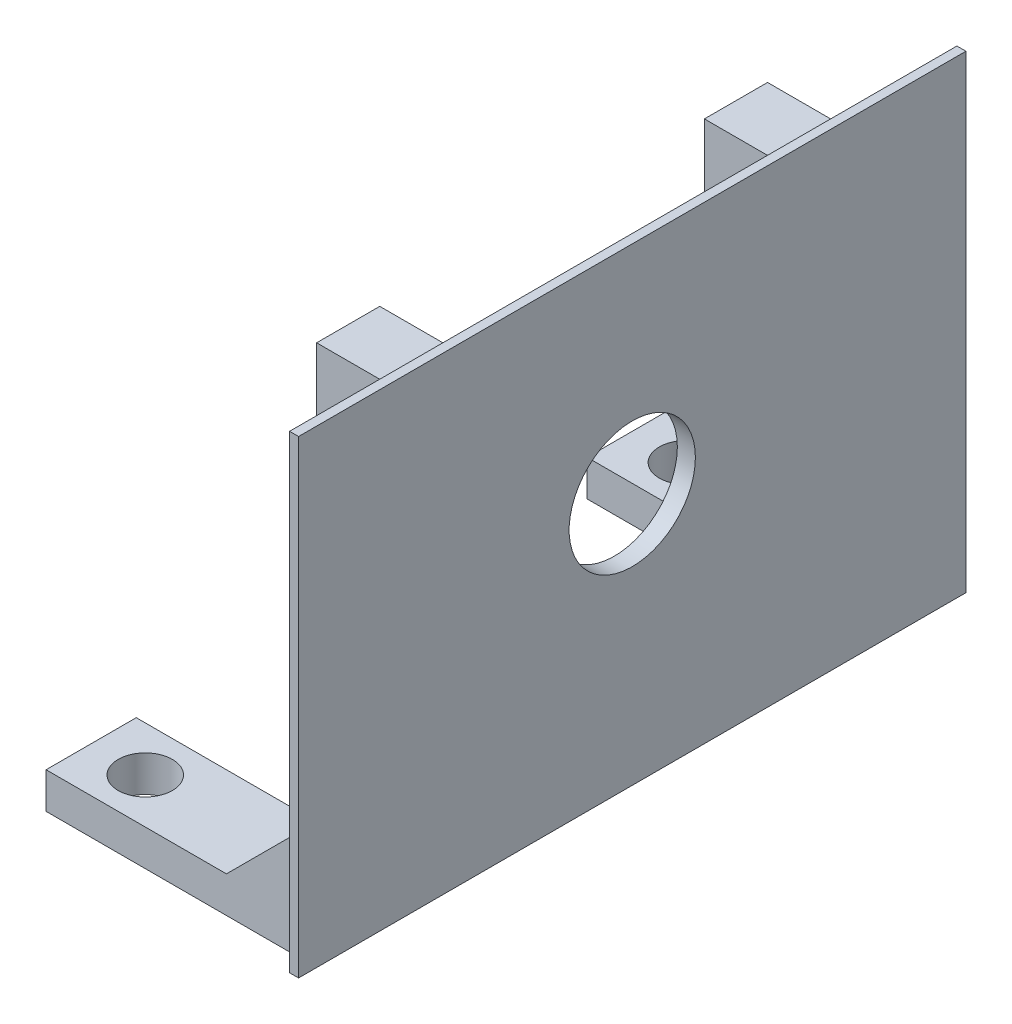
from build123d import *

# Parameters (mm, degrees)
SKIZZE2_W                      = 25
SKIZZE2_H                      = 25
SKIZZE2_R                      = 3.5
FRONT_FACE_DEPTH               = 1
SKIZZE3_W                      = 3.5
SKIZZE3_H                      = 26
SKIZZE3_R                      = 0.75
CAMERA_SPACER_DEPTH            = 4
FLOOR_PLATE_DEPTH              = 14
FLOOR_PLATE_DEPTH_BACK         = 0.5
SKIZZE6_W                      = 5
SKIZZE6_H                      = 2
SKIZZE7_W                      = 6
SKIZZE7_H                      = 26
SIDE_COVERS_DEPTH              = 0.5
TOP_COVER_REACH                = 34.669
SKIZZE8_W                      = 25
SKIZZE8_H                      = 1
FASE1_SIZE                     = 4.5
F_3_0_3_DURCHMESSER_BOHRUNG1_D = 3


with BuildPart() as part:
    # Skizze2 → Front Face (new body)
    # profile 1 of 2: a face of its own
    with BuildSketch(Plane(origin=(0, 0, 0), x_dir=(0, 0, -1), z_dir=(1, 0, 0))):
        with Locations((0, 12.5)):
            Rectangle(SKIZZE2_W, SKIZZE2_H)
        with Locations((0, 13)):
            Circle(SKIZZE2_R, mode=Mode.SUBTRACT)
    # profile 2 of 2: a face of its own
    with BuildSketch(Plane(origin=(0, 0, 0), x_dir=(0, 0, -1), z_dir=(1, 0, 0))):
        Polygon((12.5, 0), (-12.5, 0), (-17.5, 0), (-17.5, -1), (17.5, -1), (17.5, 0), align=None)
    extrude(amount=FRONT_FACE_DEPTH)

    # Skizze3 → Camera Spacer (add)
    # profile 1 of 2: a face of its own
    with BuildSketch(Plane.ZY):
        with Locations((-10.75, 12)):
            Rectangle(SKIZZE3_W, SKIZZE3_H)
        with Locations((-10.75, 14)):
            Circle(SKIZZE3_R, mode=Mode.SUBTRACT)
        with Locations((-10.75, 1.5)):
            Circle(SKIZZE3_R, mode=Mode.SUBTRACT)
    # profile 2 of 2: a face of its own
    with BuildSketch(Plane.ZY):
        with Locations((10.75, 12)):
            Rectangle(SKIZZE3_W, SKIZZE3_H)
        with Locations((10.75, 1.5)):
            Circle(SKIZZE3_R, mode=Mode.SUBTRACT)
        with Locations((10.75, 14)):
            Circle(SKIZZE3_R, mode=Mode.SUBTRACT)
    extrude(amount=CAMERA_SPACER_DEPTH)

    # Skizze6 → Floor Plate (add, two sides: drawn at the far end of the back side and taken through both)
    with BuildSketch(Plane.ZY.offset(-FLOOR_PLATE_DEPTH_BACK)):
        with Locations((-15, 0)):
            Rectangle(SKIZZE6_W, SKIZZE6_H)
        with Locations((15, 0)):
            Rectangle(SKIZZE6_W, SKIZZE6_H)
    extrude(amount=FLOOR_PLATE_DEPTH + FLOOR_PLATE_DEPTH_BACK)

    # Skizze7 → Side Covers (add)
    with BuildSketch(Plane(origin=(1, 0, 0), x_dir=(0, 0, -1), z_dir=(1, 0, 0))):
        with Locations((15.5, 12)):
            Rectangle(SKIZZE7_W, SKIZZE7_H)
        with Locations((-15.5, 12)):
            Rectangle(SKIZZE7_W, SKIZZE7_H)
    extrude(amount=-SIDE_COVERS_DEPTH)

    # Top Cover: up to this face of the body (flat: up to its plane)
    top_cover_end = Plane(part.part.faces().sort_by_distance((0.5, 12.821917808, -15.534246575))[0])
    # Skizze8 → Top Cover (cut, up to the picked face)
    with BuildSketch(Plane.ZY.offset(4), mode=Mode.PRIVATE) as top_cover_sk1:
        with Locations((0, 24.5)):
            Rectangle(SKIZZE8_W, SKIZZE8_H)
    top_cover_tool1 = split(extrude(top_cover_sk1.sketch, amount=-TOP_COVER_REACH, mode=Mode.PRIVATE), bisect_by=top_cover_end, keep=Keep.BOTH, mode=Mode.PRIVATE)
    add(top_cover_tool1.solids().sort_by(Axis((-4, 24.5, 0), (1, 0, 0)))[0], mode=Mode.SUBTRACT)

    # Fase1
    fase1_edges = [part.edges().sort_by_distance(p)[0] for p in [
        (0.5, 1, 15),
        (0.5, 1, -15),
    ]]
    chamfer(fase1_edges, length=FASE1_SIZE)

    # Ø3.0 (3) Durchmesser Bohrung1 (through all)
    with Locations(Plane(origin=(0, 1, 0), x_dir=(1, 0, 0), z_dir=(0, 1, 0))):
        with Locations((-11, 15), (-11, -15)):
            Hole(F_3_0_3_DURCHMESSER_BOHRUNG1_D / 2)


solid = part.part
